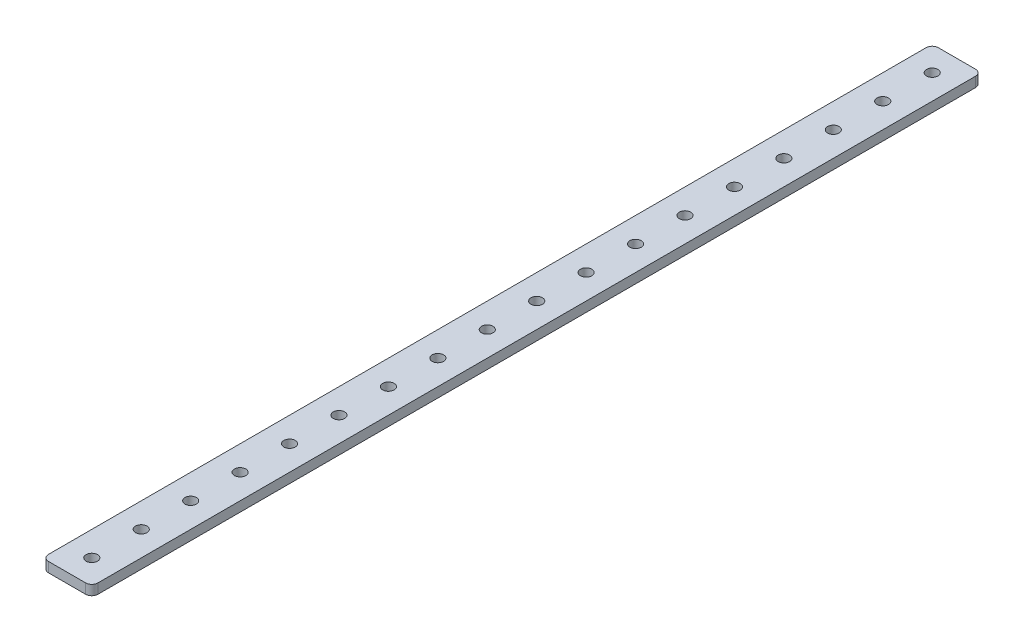
from build123d import *

# Parameters (mm, degrees)
SKETCH1_R           = 1.85
BOSS_EXTRUDE1_DEPTH = 3.2


with BuildPart() as part:
    # Sketch1 → Boss-Extrude1 (new body)
    with BuildSketch(Plane(origin=(0, 3.2, 0), x_dir=(1, 0, 0), z_dir=(0, 1, 0))):
        with BuildLine():
            Line((6, 288), (-6, 288))
            ThreePointArc((-6, 288), (-7.414213562, 287.414213562), (-8, 286))
            Line((-8, 286), (-8, 2))
            ThreePointArc((-8, 2), (-7.414213562, 0.585786438), (-6, 0))
            Line((-6, 0), (6, 0))
            ThreePointArc((6, 0), (7.414213562, 0.585786438), (8, 2))
            Line((8, 2), (8, 286))
            ThreePointArc((8, 286), (7.414213562, 287.414213562), (6, 288))
        make_face()
        with Locations(Location((0, 8, 0), (0, 0, 90))):
            Circle(SKETCH1_R, mode=Mode.SUBTRACT)
        with Locations(Location((0, 280, 0), (0, 0, 90))):
            Circle(SKETCH1_R, mode=Mode.SUBTRACT)
        with Locations(Location((0, 264, 0), (0, 0, 90))):
            Circle(SKETCH1_R, mode=Mode.SUBTRACT)
        with Locations(Location((0, 248, 0), (0, 0, 90))):
            Circle(SKETCH1_R, mode=Mode.SUBTRACT)
        with Locations(Location((0, 232, 0), (0, 0, 90))):
            Circle(SKETCH1_R, mode=Mode.SUBTRACT)
        with Locations(Location((0, 216, 0), (0, 0, 90))):
            Circle(SKETCH1_R, mode=Mode.SUBTRACT)
        with Locations(Location((0, 200, 0), (0, 0, 90))):
            Circle(SKETCH1_R, mode=Mode.SUBTRACT)
        with Locations(Location((0, 184, 0), (0, 0, 90))):
            Circle(SKETCH1_R, mode=Mode.SUBTRACT)
        with Locations(Location((0, 168, 0), (0, 0, 90))):
            Circle(SKETCH1_R, mode=Mode.SUBTRACT)
        with Locations(Location((0, 152, 0), (0, 0, 90))):
            Circle(SKETCH1_R, mode=Mode.SUBTRACT)
        with Locations(Location((0, 136, 0), (0, 0, 90))):
            Circle(SKETCH1_R, mode=Mode.SUBTRACT)
        with Locations(Location((0, 120, 0), (0, 0, 90))):
            Circle(SKETCH1_R, mode=Mode.SUBTRACT)
        with Locations(Location((0, 104, 0), (0, 0, 90))):
            Circle(SKETCH1_R, mode=Mode.SUBTRACT)
        with Locations(Location((0, 88, 0), (0, 0, 90))):
            Circle(SKETCH1_R, mode=Mode.SUBTRACT)
        with Locations(Location((0, 72, 0), (0, 0, 90))):
            Circle(SKETCH1_R, mode=Mode.SUBTRACT)
        with Locations(Location((0, 56, 0), (0, 0, 90))):
            Circle(SKETCH1_R, mode=Mode.SUBTRACT)
        with Locations(Location((0, 40, 0), (0, 0, 90))):
            Circle(SKETCH1_R, mode=Mode.SUBTRACT)
        with Locations(Location((0, 24, 0), (0, 0, 90))):
            Circle(SKETCH1_R, mode=Mode.SUBTRACT)
    extrude(amount=-BOSS_EXTRUDE1_DEPTH)


solid = part.part
